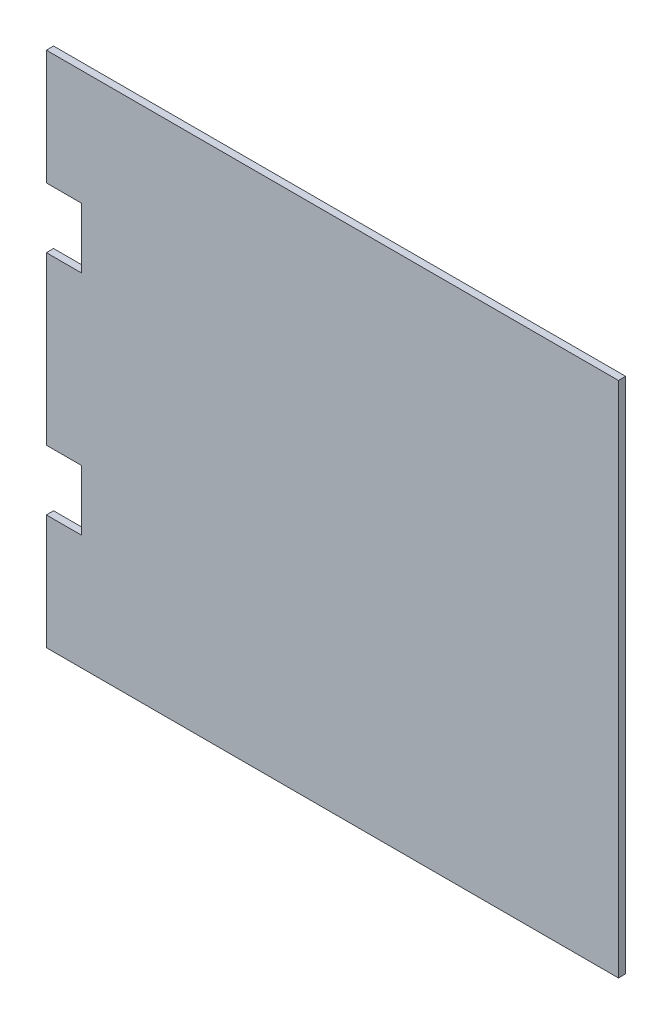
from build123d import *

# Parameters (mm, degrees)
ESQUISSE1_W             = 400
ESQUISSE1_H             = 360
BOSS_EXTRU_1_DEPTH      = 5
ESQUISSE2_W             = 26.439561959
ESQUISSE2_H             = 42
ENL_V_MAT_EXTRU_1_DEPTH = 5
ESQUISSE3_W             = 5
ESQUISSE3_H             = 116
ESQUISSE3_H_2           = 80
ENL_V_MAT_EXTRU_2_DEPTH = 2


with BuildPart() as part:
    # Esquisse1 → Boss.-Extru.1 (new body)
    with BuildSketch(Plane.XY):
        Rectangle(ESQUISSE1_W, ESQUISSE1_H)
    extrude(amount=BOSS_EXTRU_1_DEPTH)

    # Esquisse2 → Enlèv. mat.-Extru.1 (cut)
    with BuildSketch(Plane.XY.offset(5)):
        with Locations((-186.78021902, 79)):
            Rectangle(ESQUISSE2_W, ESQUISSE2_H)
        with Locations((-186.78021902, -79)):
            Rectangle(ESQUISSE2_W, ESQUISSE2_H)
    extrude(amount=-ENL_V_MAT_EXTRU_1_DEPTH, mode=Mode.SUBTRACT)

    # Esquisse3 → Enlèv. mat.-Extru.2 (cut)
    with BuildSketch(Plane.ZY.offset(200)):
        with Locations((2.5, 0)):
            Rectangle(ESQUISSE3_W, ESQUISSE3_H)
        with Locations((2.5, 140)):
            Rectangle(ESQUISSE3_W, ESQUISSE3_H_2)
        with Locations((2.5, -140)):
            Rectangle(ESQUISSE3_W, ESQUISSE3_H_2)
    extrude(amount=-ENL_V_MAT_EXTRU_2_DEPTH, mode=Mode.SUBTRACT)


solid = part.part
